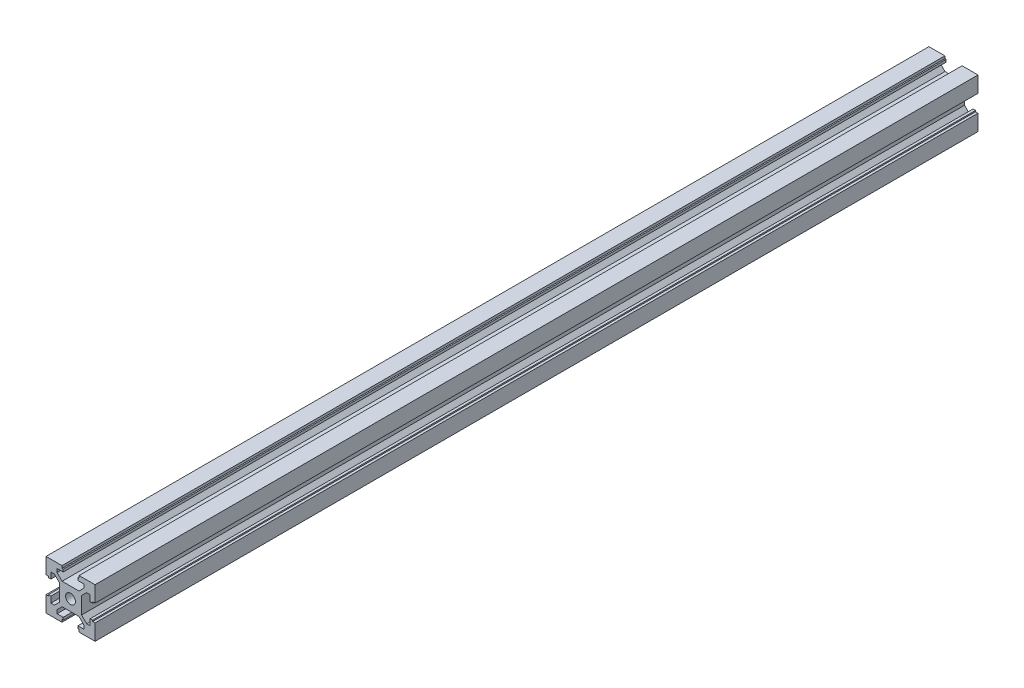
from build123d import *

# Parameters (mm, degrees)
SKETCH1_R           = 2
BOSS_EXTRUDE1_DEPTH = 360


with BuildPart() as part:
    # Sketch1 → Boss-Extrude1 (new body)
    with BuildSketch(Plane.XY):
        Polygon((-10, -10), (-3.5, -10), (-3.5, -9), (-3, -9), (-3, -8), (-5.5, -8), (-5.5, -6.560660172), (-3.44, -4.500660172), (3.44, -4.500660172), (5.5, -6.560660172), (5.5, -8), (3, -8), (3, -9), (3.5, -9), (3.5, -10), (10, -10), (10, -3.5), (9, -3.5), (9, -3), (8, -3), (8, -5.5), (6.560660172, -5.5), (4.500660172, -3.44), (4.500660172, 3.44), (6.560660172, 5.5), (8, 5.5), (8, 3), (9, 3), (9, 3.5), (10, 3.5), (10, 10), (3.5, 10), (3.5, 9), (3, 9), (3, 8), (5.5, 8), (5.5, 6.560660172), (3.44, 4.500660172), (-3.44, 4.500660172), (-5.5, 6.560660172), (-5.5, 8), (-3, 8), (-3, 9), (-3.5, 9), (-3.5, 10), (-10, 10), (-10, 3.5), (-9, 3.5), (-9, 3), (-8, 3), (-8, 5.5), (-6.560660172, 5.5), (-4.500660172, 3.44), (-4.500660172, -3.44), (-6.560660172, -5.5), (-8, -5.5), (-8, -3), (-9, -3), (-9, -3.5), (-10, -3.5), align=None)
        with Locations(Location((0, 0, 0), (0, 0, 180))):
            Circle(SKETCH1_R, mode=Mode.SUBTRACT)
    extrude(amount=BOSS_EXTRUDE1_DEPTH)


solid = part.part
